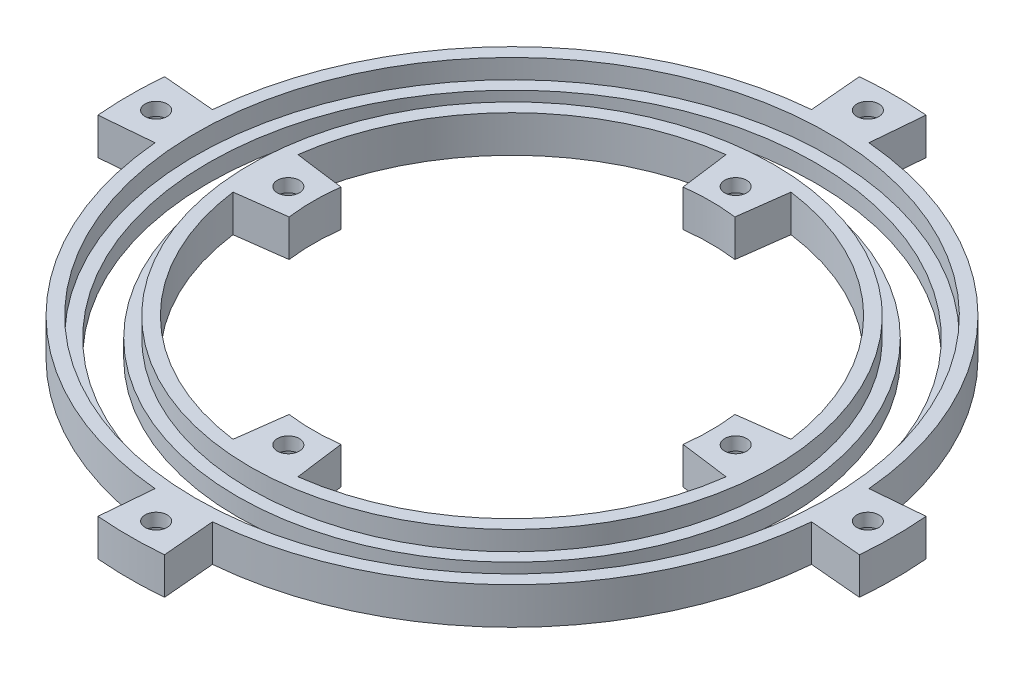
from build123d import *

# Parameters (mm, degrees)
SKETCH_1_R               = 37.5
SKETCH_1_R_2             = 34.5
EXTRUDE_3_DEPTH          = 4.2
SKETCH_1_R_3             = 31.3
SKETCH_1_R_4             = 28.3
EXTRUDE_3_2_DEPTH        = 4.2
SKETCH_3_R               = 36
SKETCH_3_R_2             = 29.8
CUT_EXTRUDE_1_DEPTH      = 2.2
EXTRUDE_START            = -4.2
SKETCH_4_R               = 1.25
EXTRUDE_4_DEPTH          = 4.2
SKETCH_4_3_R             = 2
CUT_EXTRUDE_2_DEPTH      = 2.7
PATTERN_CIRCULAR_2_COUNT = 4
EXTRUDE_5_DEPTH          = 4.2
SKETCH_5_3_R             = 2
CUT_EXTRUDE_3_DEPTH      = 2.7
PATTERN_CIRCULAR_3_COUNT = 4
SKETCH_6_R               = 34.55
SKETCH_6_R_2             = 31.25
CUT_EXTRUDE_4_DEPTH      = 62.661495279


with BuildPart() as part:
    # 草图1 → 凸台-拉伸3 (new body)
    with BuildSketch(Plane(origin=(0, 0, 0), x_dir=(1, 0, 0), z_dir=(0, 1, 0))):
        with Locations(Location((0, 0, 0), (0, 0, 270))):
            Circle(SKETCH_1_R)
        with Locations(Location((0, 0, 0), (0, 0, 270))):
            Circle(SKETCH_1_R_2, mode=Mode.SUBTRACT)
    extrude(amount=EXTRUDE_3_DEPTH)


with BuildPart() as body_2:
    # 草图1 → Extrude 3 2 (new body)
    with BuildSketch(Plane(origin=(0, 0, 0), x_dir=(1, 0, 0), z_dir=(0, 1, 0))):
        with Locations(Location((0, 0, 0), (0, 0, 270))):
            Circle(SKETCH_1_R_3)
        with Locations(Location((0, 0, 0), (0, 0, 270))):
            Circle(SKETCH_1_R_4, mode=Mode.SUBTRACT)
    extrude(amount=EXTRUDE_3_2_DEPTH)


with BuildPart() as cut_extrude_1_tool:
    # 草图3 → 切除-拉伸1 (new body)
    with BuildSketch(Plane(origin=(0, 4.2, 0), x_dir=(1, 0, 0), z_dir=(0, 1, 0))):
        with Locations(Location((0, 0, 0), (0, 0, 270))):
            Circle(SKETCH_3_R)
        with Locations(Location((0, 0, 0), (0, 0, 270))):
            Circle(SKETCH_3_R_2, mode=Mode.SUBTRACT)
    extrude(amount=-CUT_EXTRUDE_1_DEPTH)


with BuildPart() as part_1:
    add(part.part)

    # 切除-拉伸1: cut by cut_extrude_1_tool
    add(cut_extrude_1_tool.part, mode=Mode.SUBTRACT)

    # 草图4 → 凸台-拉伸4 (add)
    with BuildSketch(Plane.XZ.offset(EXTRUDE_START)):
        with BuildLine():
            Line((-3.79127481, 43.334469367), (-3.268340353, 37.357301178))
            ThreePointArc((-3.268340353, 37.357301178), (0, 37.5), (3.268340353, 37.357301178))
            Line((3.268340353, 37.357301178), (3.79127481, 43.334469367))
            ThreePointArc((3.79127481, 43.334469367), (0, 43.5), (-3.79127481, 43.334469367))
        make_face()
        with Locations(Location((0, 40.5, 0), (0, 0, 270))):
            Circle(SKETCH_4_R, mode=Mode.SUBTRACT)
    extrude_4 = extrude(amount=EXTRUDE_4_DEPTH)

    # 草图4<3> → 切除-拉伸2 (cut)
    with BuildSketch(Plane.XZ):
        with Locations(Location((0, 40.5, 0), (0, 0, 270))):
            Circle(SKETCH_4_3_R)
    cut_extrude_2 = extrude(amount=-CUT_EXTRUDE_2_DEPTH, mode=Mode.SUBTRACT)

    # 阵列(圆周)2: 凸台-拉伸4, 切除-拉伸2 ×4 about axis
    pattern_circular_2_axis = Axis((0, 0, 0), (0, 1, 0))
    add([extrude_4.rotate(pattern_circular_2_axis, i * 360 / PATTERN_CIRCULAR_2_COUNT) for i in range(1, PATTERN_CIRCULAR_2_COUNT)])
    add([cut_extrude_2.rotate(pattern_circular_2_axis, i * 360 / PATTERN_CIRCULAR_2_COUNT) for i in range(1, PATTERN_CIRCULAR_2_COUNT)], mode=Mode.SUBTRACT)


with BuildPart() as body_2_1:
    add(body_2.part)

    # 切除-拉伸1: cut by cut_extrude_1_tool
    add(cut_extrude_1_tool.part, mode=Mode.SUBTRACT)

    # 草图5 → 凸台-拉伸5 (add)
    with BuildSketch(Plane.XZ):
        with BuildLine():
            ThreePointArc((3.69389124, 28.057889577), (1.850908557, 28.239407528), (0, 28.3))
            Line((0, 28.3), (0, 27.455481199))
            ThreePointArc((0, 27.455481199), (1.414213562, 26.869694761), (2, 25.455481199))
            ThreePointArc((2, 25.455481199), (1.414213562, 24.041267636), (0, 23.455481199))
            Line((0, 23.455481199), (0, 22.610962398))
            ThreePointArc((0, 22.610962398), (1.478827696, 22.562550592), (2.951322824, 22.41752248))
            Line((2.951322824, 22.41752248), (3.69389124, 28.057889577))
        make_face()
        with BuildLine():
            Line((0, 27.455481199), (0, 28.3))
            ThreePointArc((0, 28.3), (-1.850908557, 28.239407528), (-3.69389124, 28.057889577))
            Line((-3.69389124, 28.057889577), (-2.951322824, 22.41752248))
            ThreePointArc((-2.951322824, 22.41752248), (-1.478827696, 22.562550592), (0, 22.610962398))
            Line((0, 22.610962398), (0, 23.455481199))
            ThreePointArc((0, 23.455481199), (-2, 25.455481199), (0, 27.455481199))
        make_face()
        with BuildLine():
            ThreePointArc((2, 25.455481199), (1.414213562, 26.869694761), (0, 27.455481199))
            Line((0, 27.455481199), (0, 26.705481199))
            ThreePointArc((0, 26.705481199), (0.883883476, 26.339364675), (1.25, 25.455481199))
            ThreePointArc((1.25, 25.455481199), (0.883883476, 24.571597722), (0, 24.205481199))
            Line((0, 24.205481199), (0, 23.455481199))
            ThreePointArc((0, 23.455481199), (1.414213562, 24.041267636), (2, 25.455481199))
        make_face()
        with BuildLine():
            Line((0, 26.705481199), (0, 27.455481199))
            ThreePointArc((0, 27.455481199), (-2, 25.455481199), (0, 23.455481199))
            Line((0, 23.455481199), (0, 24.205481199))
            ThreePointArc((0, 24.205481199), (-1.25, 25.455481199), (0, 26.705481199))
        make_face()
    extrude_5 = extrude(amount=-EXTRUDE_5_DEPTH)

    # 草图5<3> → 切除-拉伸3 (cut)
    with BuildSketch(Plane.XZ):
        with Locations(Location((0, 25.455481199, 0), (0, 0, 270))):
            Circle(SKETCH_5_3_R)
    cut_extrude_3 = extrude(amount=-CUT_EXTRUDE_3_DEPTH, mode=Mode.SUBTRACT)

    # 阵列(圆周)3: 凸台-拉伸5, 切除-拉伸3 ×4 about axis
    pattern_circular_3_axis = Axis((0, 0, 0), (0, 1, 0))
    add([extrude_5.rotate(pattern_circular_3_axis, i * 360 / PATTERN_CIRCULAR_3_COUNT) for i in range(1, PATTERN_CIRCULAR_3_COUNT)])
    add([cut_extrude_3.rotate(pattern_circular_3_axis, i * 360 / PATTERN_CIRCULAR_3_COUNT) for i in range(1, PATTERN_CIRCULAR_3_COUNT)], mode=Mode.SUBTRACT)


with BuildPart() as cut_extrude_4_tool:
    # 草图6 → 切除-拉伸4 (new, through all)
    with BuildSketch(Plane.XZ):
        with Locations(Location((0, 0, 0), (0, 0, 270))):
            Circle(SKETCH_6_R)
        with Locations(Location((0, 0, 0), (0, 0, 270))):
            Circle(SKETCH_6_R_2, mode=Mode.SUBTRACT)
    extrude(amount=-CUT_EXTRUDE_4_DEPTH)


with BuildPart() as part_2:
    add(part_1.part)

    # 切除-拉伸4: cut by cut_extrude_4_tool
    add(cut_extrude_4_tool.part, mode=Mode.SUBTRACT)


with BuildPart() as body_2_2:
    add(body_2_1.part)

    # 切除-拉伸4: cut by cut_extrude_4_tool
    add(cut_extrude_4_tool.part, mode=Mode.SUBTRACT)


solid = Compound([part_2.part, body_2_2.part])
